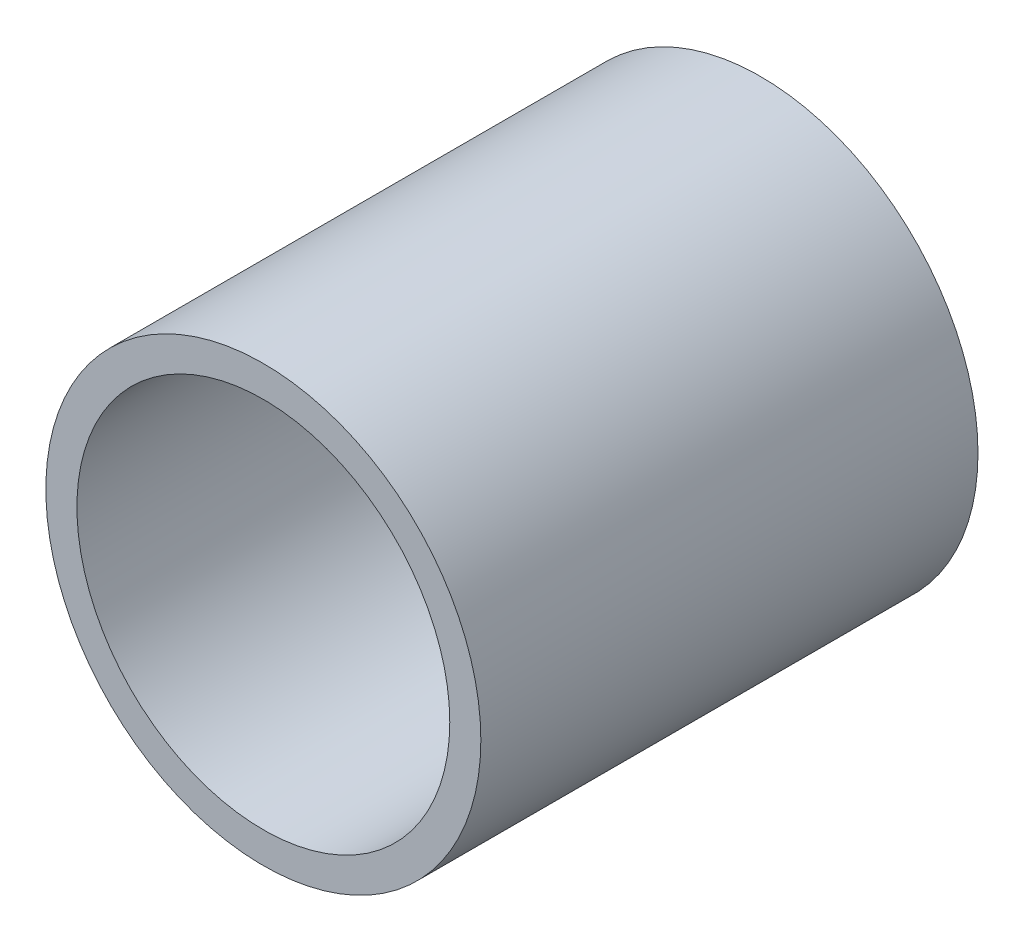
from build123d import *

# Parameters (mm, degrees)
SKETCH1_R           = 7
SKETCH1_R_2         = 6
BOSS_EXTRUDE1_DEPTH = 16


with BuildPart() as part:
    # Sketch1 → Boss-Extrude1 (new body)
    with BuildSketch(Plane.XY):
        Circle(SKETCH1_R)
        Circle(SKETCH1_R_2, mode=Mode.SUBTRACT)
    extrude(amount=BOSS_EXTRUDE1_DEPTH)


solid = part.part
